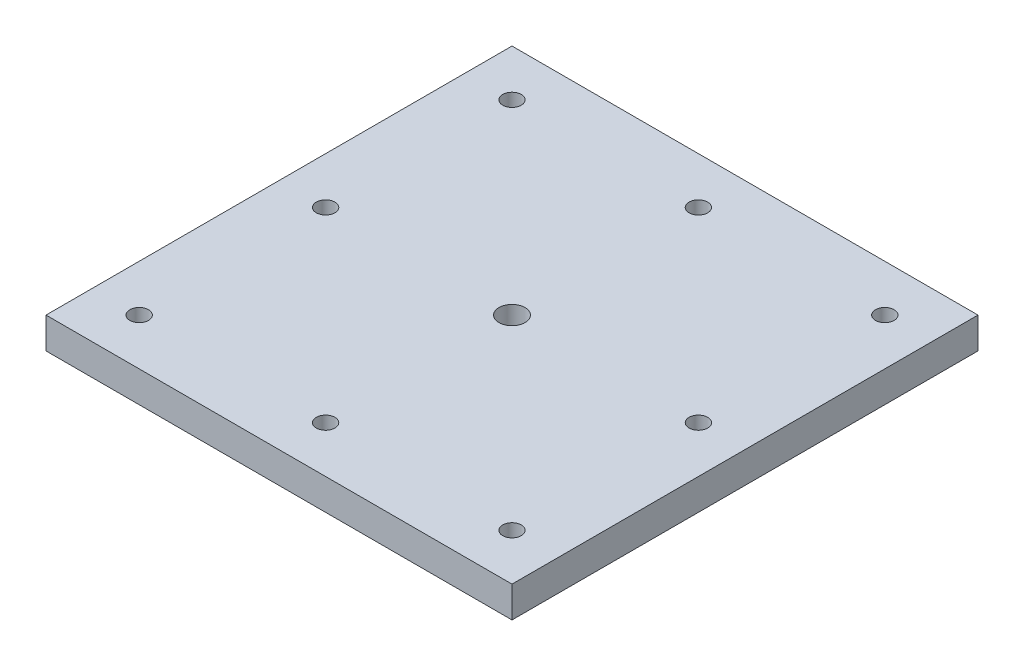
from build123d import *

# Parameters (mm, degrees)
CROQUIS1_W              = 75
CROQUIS1_H              = 75
CROQUIS1_R              = 1.5
CROQUIS1_R_2            = 2.1
SALIENTE_EXTRUIR1_DEPTH = 5


with BuildPart() as part:
    # Croquis1 → Saliente-Extruir1 (new body)
    with BuildSketch(Plane(origin=(0, 0, 0), x_dir=(1, 0, 0), z_dir=(0, 1, 0))):
        Rectangle(CROQUIS1_W, CROQUIS1_H)
        with Locations(Location((30, 0, 0), (0, 0, 270))):
            Circle(CROQUIS1_R, mode=Mode.SUBTRACT)
        with Locations(Location((30, 30, 0), (0, 0, 270))):
            Circle(CROQUIS1_R, mode=Mode.SUBTRACT)
        with Locations(Location((0, 30, 0), (0, 0, 270))):
            Circle(CROQUIS1_R, mode=Mode.SUBTRACT)
        with Locations(Location((-30, 30, 0), (0, 0, 270))):
            Circle(CROQUIS1_R, mode=Mode.SUBTRACT)
        with Locations(Location((-30, 0, 0), (0, 0, 270))):
            Circle(CROQUIS1_R, mode=Mode.SUBTRACT)
        with Locations(Location((-30, -30, 0), (0, 0, 270))):
            Circle(CROQUIS1_R, mode=Mode.SUBTRACT)
        with Locations(Location((0, -30, 0), (0, 0, 270))):
            Circle(CROQUIS1_R, mode=Mode.SUBTRACT)
        with Locations(Location((30, -30, 0), (0, 0, 270))):
            Circle(CROQUIS1_R, mode=Mode.SUBTRACT)
        with Locations(Location((0, 0, 0), (0, 0, 270))):
            Circle(CROQUIS1_R_2, mode=Mode.SUBTRACT)
    extrude(amount=SALIENTE_EXTRUIR1_DEPTH)


solid = part.part
